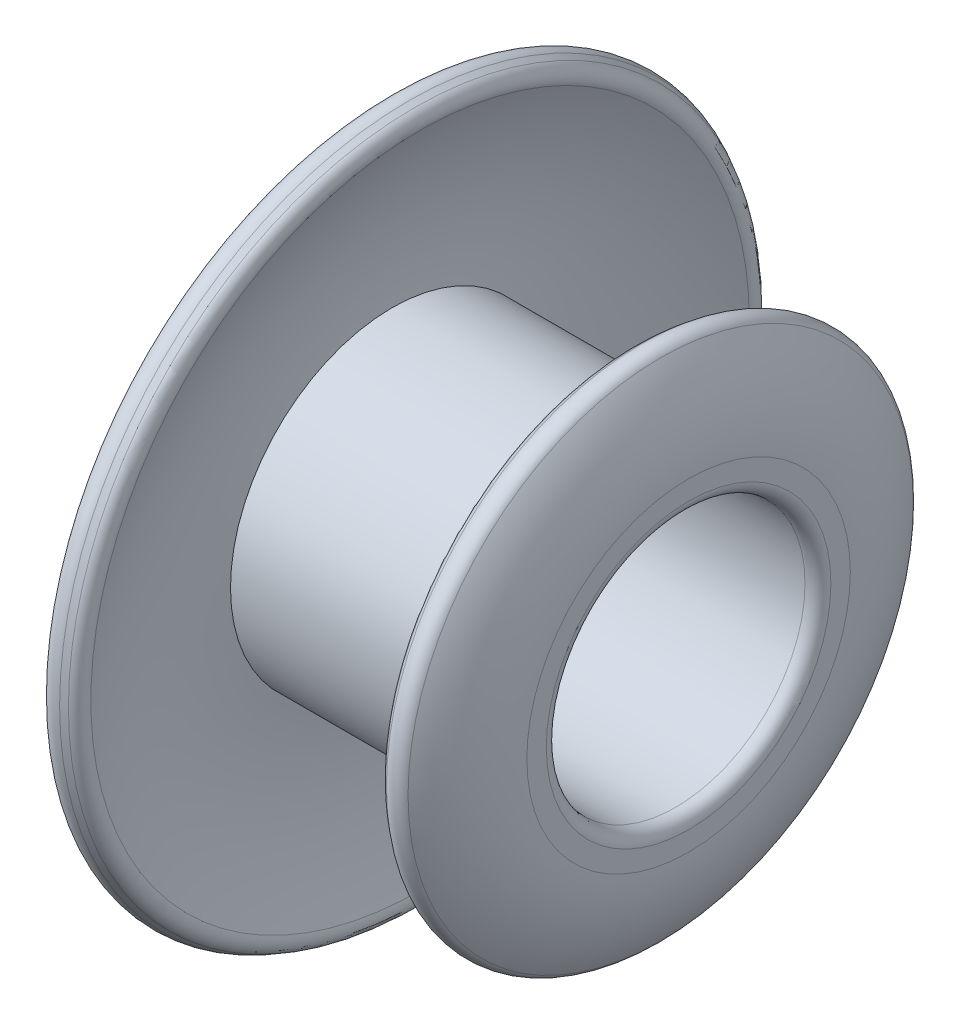
from build123d import *

# Parameters (mm, degrees)
FILLET1_R = 0.1


with BuildPart() as part:
    # Sketch1 → Revolve1 (revolve)
    with BuildSketch(Plane.XY, mode=Mode.PRIVATE) as revolve1_sk:
        with BuildLine():
            ThreePointArc((0, 1.25), (-0.057874055, 1.58525916), (-0.224797408, 1.881712705))
            Line((-0.224797408, 1.881712705), (-0.03099676, 2.039640881))
            ThreePointArc((-0.03099676, 2.039640881), (0.177657431, 1.66907395), (0.25, 1.25))
            Line((0.25, 1.25), (0.25, 1))
            Line((0.25, 1), (-2.25, 1))
            ThreePointArc((-2.25, 1), (-2.284841337, 1.897834477), (-2, 2.75))
            Line((-2, 2.75), (-1.78099676, 2.629428109))
            ThreePointArc((-1.78099676, 2.629428109), (-2.021139042, 1.960479194), (-2.040639843, 1.25))
            Line((-2.040639843, 1.25), (-2, 1.25))
            Line((-2, 1.25), (0, 1.25))
        make_face()
    revolve(revolve1_sk.sketch.rotate(Axis((0, 0, 0), (-1, 0, 0)), 90), axis=Axis((0, 0, 0), (-1, 0, 0)))

    # Fillet1
    fillet1_edges = [part.edges().sort_by_distance(p)[0] for p in [
        (-2, 0, 2.75),
        (-1.78099676, 0, 2.629428109),
        (-0.224797408, 0, 1.881712705),
        (-0.03099676, 0, 2.039640881),
        (0.25, 0, 1),
        (-2.25, 0, 1),
    ]]
    fillet(fillet1_edges, radius=FILLET1_R)


solid = part.part
